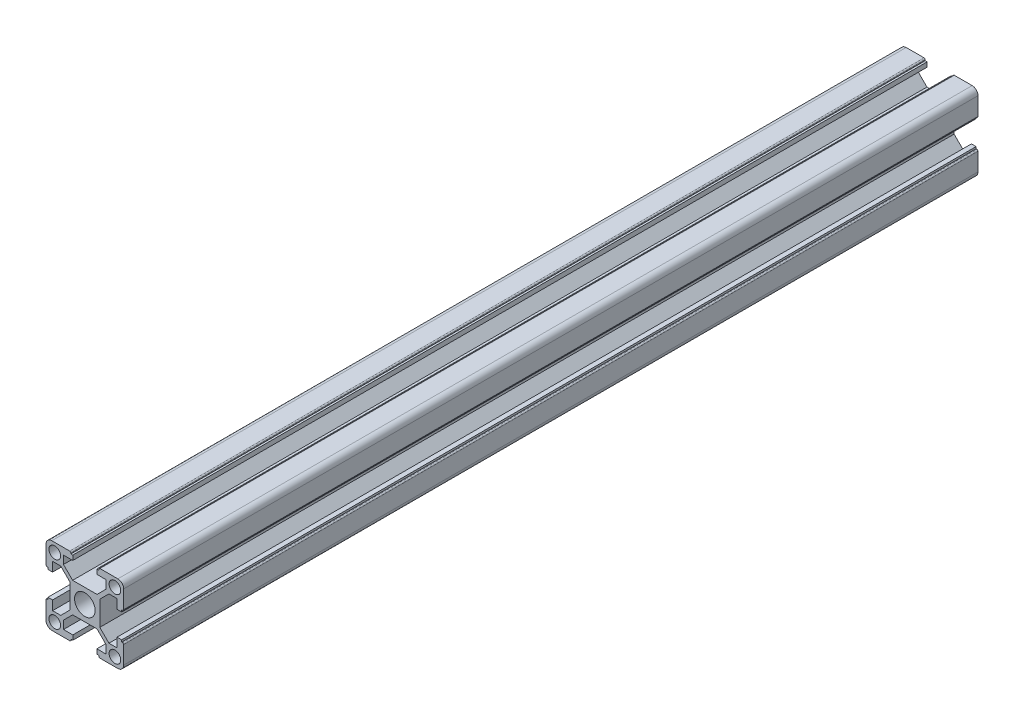
from build123d import *

# Parameters (mm, degrees)
SKETCH_1_R          = 2.65
SKETCH_1_R_2        = 1.5
EXTRUDE_1_DEPTH     = 110
SKETCH_4_R          = 2
CUT_EXTRUDE_3_DEPTH = 112.318563142


with BuildPart() as part:
    # 草图1 → 凸台-拉伸1 (new, symmetric)
    with BuildSketch(Plane.XY):
        with BuildLine():
            Line((3.142893219, 3.85), (-3.142893219, 3.85))
            Line((-3.142893219, 3.85), (-5.5, 6.207106781))
            Line((-5.5, 6.207106781), (-5.5, 8.3))
            Line((-5.5, 8.3), (-3.1, 8.3))
            Line((-3.1, 8.3), (-3.1, 9.5))
            Line((-3.1, 9.5), (-3.6, 9.5))
            Line((-3.6, 9.5), (-3.6, 9.7))
            ThreePointArc((-3.6, 9.7), (-3.687867966, 9.912132034), (-3.9, 10))
            Line((-3.9, 10), (-8.5, 10))
            ThreePointArc((-8.5, 10), (-9.560660172, 9.560660172), (-10, 8.5))
            Line((-10, 8.5), (-10, 3.9))
            ThreePointArc((-10, 3.9), (-9.912132034, 3.687867966), (-9.7, 3.6))
            Line((-9.7, 3.6), (-9.5, 3.6))
            Line((-9.5, 3.6), (-9.5, 3.1))
            Line((-9.5, 3.1), (-8.3, 3.1))
            Line((-8.3, 3.1), (-8.3, 5.5))
            Line((-8.3, 5.5), (-6.207106781, 5.5))
            Line((-6.207106781, 5.5), (-3.85, 3.142893219))
            Line((-3.85, 3.142893219), (-3.85, -3.142893219))
            Line((-3.85, -3.142893219), (-6.207106781, -5.5))
            Line((-6.207106781, -5.5), (-8.3, -5.5))
            Line((-8.3, -5.5), (-8.3, -3.1))
            Line((-8.3, -3.1), (-9.5, -3.1))
            Line((-9.5, -3.1), (-9.5, -3.6))
            Line((-9.5, -3.6), (-9.7, -3.6))
            ThreePointArc((-9.7, -3.6), (-9.912132034, -3.687867966), (-10, -3.9))
            Line((-10, -3.9), (-10, -8.5))
            ThreePointArc((-10, -8.5), (-9.560660172, -9.560660172), (-8.5, -10))
            Line((-8.5, -10), (-3.9, -10))
            ThreePointArc((-3.9, -10), (-3.687867966, -9.912132034), (-3.6, -9.7))
            Line((-3.6, -9.7), (-3.6, -9.5))
            Line((-3.6, -9.5), (-3.1, -9.5))
            Line((-3.1, -9.5), (-3.1, -8.3))
            Line((-3.1, -8.3), (-5.5, -8.3))
            Line((-5.5, -8.3), (-5.5, -6.207106781))
            Line((-5.5, -6.207106781), (-3.142893219, -3.85))
            Line((-3.142893219, -3.85), (3.142893219, -3.85))
            Line((3.142893219, -3.85), (5.5, -6.207106781))
            Line((5.5, -6.207106781), (5.5, -8.3))
            Line((5.5, -8.3), (3.1, -8.3))
            Line((3.1, -8.3), (3.1, -9.5))
            Line((3.1, -9.5), (3.6, -9.5))
            Line((3.6, -9.5), (3.6, -9.7))
            ThreePointArc((3.6, -9.7), (3.687867966, -9.912132034), (3.9, -10))
            Line((3.9, -10), (8.5, -10))
            ThreePointArc((8.5, -10), (9.560660172, -9.560660172), (10, -8.5))
            Line((10, -8.5), (10, -3.9))
            ThreePointArc((10, -3.9), (9.912132034, -3.687867966), (9.7, -3.6))
            Line((9.7, -3.6), (9.5, -3.6))
            Line((9.5, -3.6), (9.5, -3.1))
            Line((9.5, -3.1), (8.3, -3.1))
            Line((8.3, -3.1), (8.3, -5.5))
            Line((8.3, -5.5), (6.207106781, -5.5))
            Line((6.207106781, -5.5), (3.85, -3.142893219))
            Line((3.85, -3.142893219), (3.85, 3.142893219))
            Line((3.85, 3.142893219), (6.207106781, 5.5))
            Line((6.207106781, 5.5), (8.3, 5.5))
            Line((8.3, 5.5), (8.3, 3.1))
            Line((8.3, 3.1), (9.5, 3.1))
            Line((9.5, 3.1), (9.5, 3.6))
            Line((9.5, 3.6), (9.7, 3.6))
            ThreePointArc((9.7, 3.6), (9.912132034, 3.687867966), (10, 3.9))
            Line((10, 3.9), (10, 8.5))
            ThreePointArc((10, 8.5), (9.560660172, 9.560660172), (8.5, 10))
            Line((8.5, 10), (3.9, 10))
            ThreePointArc((3.9, 10), (3.687867966, 9.912132034), (3.6, 9.7))
            Line((3.6, 9.7), (3.6, 9.5))
            Line((3.6, 9.5), (3.1, 9.5))
            Line((3.1, 9.5), (3.1, 8.3))
            Line((3.1, 8.3), (5.5, 8.3))
            Line((5.5, 8.3), (5.5, 6.207106781))
            Line((5.5, 6.207106781), (3.142893219, 3.85))
        make_face()
        Circle(SKETCH_1_R, mode=Mode.SUBTRACT)
        with Locations((-7.75, 7.75)):
            Circle(SKETCH_1_R_2, mode=Mode.SUBTRACT)
        with Locations((7.75, 7.75)):
            Circle(SKETCH_1_R_2, mode=Mode.SUBTRACT)
        with Locations((7.75, -7.75)):
            Circle(SKETCH_1_R_2, mode=Mode.SUBTRACT)
        with Locations((-7.75, -7.75)):
            Circle(SKETCH_1_R_2, mode=Mode.SUBTRACT)
    extrude(amount=EXTRUDE_1_DEPTH, both=True)

    # 草图4 → 切除-拉伸3 (cut, through all)
    with BuildSketch(Plane(origin=(3.85, 0, 0), x_dir=(0, 0, -1), z_dir=(1, 0, 0))):
        with Locations((-100, 0)):
            Circle(SKETCH_4_R)
        with Locations((100, 0)):
            Circle(SKETCH_4_R)
        with Locations((-10, 0)):
            Circle(SKETCH_4_R)
        with Locations((10, 0)):
            Circle(SKETCH_4_R)
    extrude(amount=-CUT_EXTRUDE_3_DEPTH, mode=Mode.SUBTRACT)


solid = part.part
